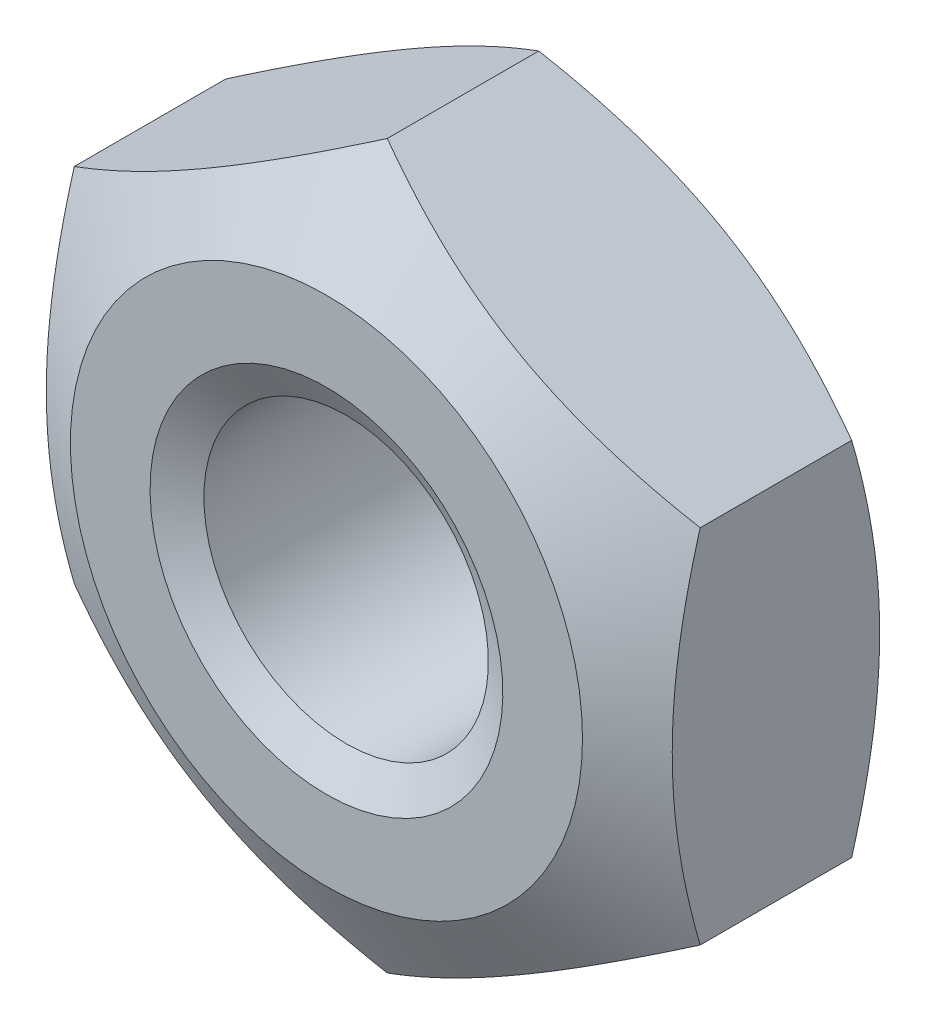
from build123d import *

# Parameters (mm, degrees)
BOSS_EXTRUDE1_DEPTH = 2.4


with BuildPart() as part:
    # Sketch1 → Boss-Extrude1 (new body)
    with BuildSketch(Plane.XY):
        Polygon((0, 3.175426481), (-2.75, 1.58771324), (-2.75, -1.58771324), (0, -3.175426481), (2.75, -1.58771324), (2.75, 1.58771324), align=None)
    extrude(amount=-BOSS_EXTRUDE1_DEPTH)

    # Sketch4 → Cut-Revolve1 (revolve, cut)
    with BuildSketch(Plane(origin=(0, 0, 0), x_dir=(0, 0, -1), z_dir=(1, 0, 0)), mode=Mode.PRIVATE) as cut_revolve1_sk:
        Polygon((2.4, 3.175426481), (1.865704772, 3.175426481), (2.4, 2.25), align=None)
        Polygon((0, 3.175426481), (0.534295228, 3.175426481), (0, 2.25), align=None)
    revolve(cut_revolve1_sk.sketch.rotate(Axis((0, 0, 0), (0, 0, -1)), 299.99999992), axis=Axis((0, 0, 0), (0, 0, -1)), mode=Mode.SUBTRACT)

    # Sketch5 → Cut-Revolve2 (revolve, cut)
    with BuildSketch(Plane(origin=(0, 0, 0), x_dir=(0, 0, -1), z_dir=(1, 0, 0)), mode=Mode.PRIVATE) as cut_revolve2_sk:
        Polygon((0, 0), (0, 1.55), (0.173205081, 1.25), (2.226794919, 1.25), (2.4, 1.55), (2.4, 0), align=None)
    revolve(cut_revolve2_sk.sketch.rotate(Axis((0, 0, 0), (0, 0, -1)), 180), axis=Axis((0, 0, 0), (0, 0, -1)), mode=Mode.SUBTRACT)


solid = part.part
